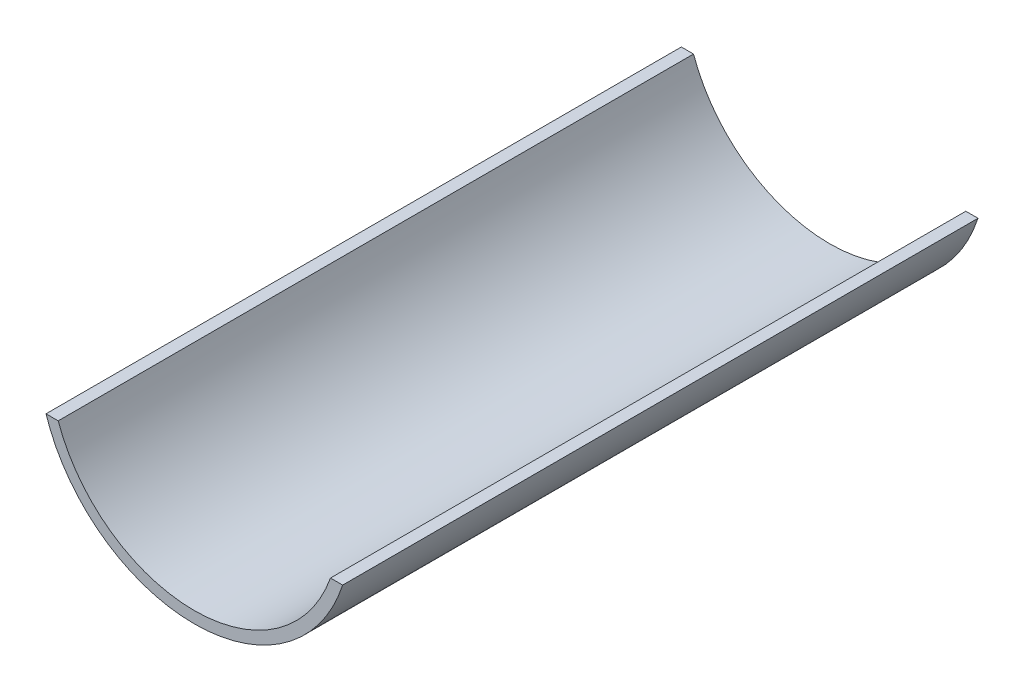
from build123d import *

# Parameters (mm, degrees)
BOSS_EXTRUDE1_DEPTH = 330


with BuildPart() as part:
    # Sketch1 → Boss-Extrude1 (new body)
    with BuildSketch(Plane.XY):
        with BuildLine():
            Line((77.045441137, -25), (70.710678119, -25))
            ThreePointArc((70.710678119, -25), (0, -75), (-70.710678119, -25))
            Line((-70.710678119, -25), (-77.045441137, -25))
            ThreePointArc((-77.045441137, -25), (0, -81), (77.045441137, -25))
        make_face()
    extrude(amount=BOSS_EXTRUDE1_DEPTH)


solid = part.part
